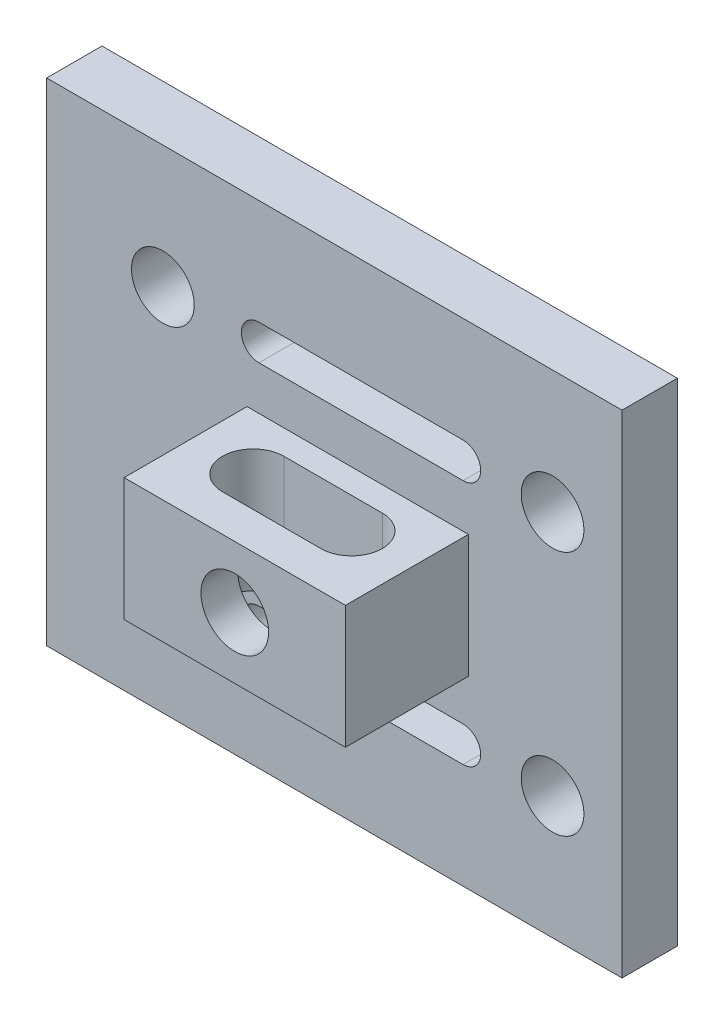
from build123d import *

# Parameters (mm, degrees)
SKETCH_1_W          = 46.8
SKETCH_1_H          = 20
SKETCH_1_R          = 2.55
EXTRUDE_1_DEPTH     = 4.5
CUT_EXTRUDE_1_DEPTH = 8
SKETCH_9_W          = 18
SKETCH_9_H          = 10
EXTRUDE_2_DEPTH     = 10
CUT_EXTRUDE_3_DEPTH = 10
SKETCH_12_R         = 2.75
CUT_EXTRUDE_4_DEPTH = 3


with BuildPart() as part:
    # 草图1 → 凸台-拉伸1 (new body)
    with BuildSketch(Plane.XY):
        with Locations((-1.9, 0)):
            Rectangle(SKETCH_1_W, SKETCH_1_H)
        with Locations((-15.85, 0)):
            Circle(SKETCH_1_R, mode=Mode.SUBTRACT)
        with Locations((15.85, 0)):
            Circle(SKETCH_1_R, mode=Mode.SUBTRACT)
    extrude_1 = extrude(amount=EXTRUDE_1_DEPTH)

    # 草图8 → 切除-拉伸1 (cut)
    with BuildSketch(Plane(origin=(0, 0, 0), x_dir=(-1, 0, 0), z_dir=(0, 0, -1))):
        with BuildLine():
            Line((-8.572541507, 1.430395913), (8.030268199, 1.430395913))
            ThreePointArc((8.030268199, 1.430395913), (9.460664112, 0), (8.030268199, -1.430395913))
            Line((8.030268199, -1.430395913), (-8.572541507, -1.430395913))
            ThreePointArc((-8.572541507, -1.430395913), (-10.00293742, 0), (-8.572541507, 1.430395913))
        make_face()
    cut_extrude_1 = extrude(amount=-CUT_EXTRUDE_1_DEPTH, mode=Mode.SUBTRACT)

    # 镜向1: 凸台-拉伸1 across plane
    add(extrude_1.mirror(Plane.ZX.offset(10)))

    # 镜向3: 切除-拉伸1 across plane
    add(cut_extrude_1.mirror(Plane.ZX.offset(10)), mode=Mode.SUBTRACT)

    # 草图9 → 凸台-拉伸2 (add)
    with BuildSketch(Plane.XY.offset(4.5)):
        with Locations((0, 10)):
            Rectangle(SKETCH_9_W, SKETCH_9_H)
    extrude(amount=EXTRUDE_2_DEPTH)

    # 草图11 → 切除-拉伸3 (cut)
    with BuildSketch(Plane.XZ.offset(-5)):
        with BuildLine():
            Line((-4, 11.5), (4, 11.5))
            ThreePointArc((4, 11.5), (6.5, 9), (4, 6.5))
            Line((4, 6.5), (-4, 6.5))
            ThreePointArc((-4, 6.5), (-6.5, 9), (-4, 11.5))
        make_face()
    extrude(amount=-CUT_EXTRUDE_3_DEPTH, mode=Mode.SUBTRACT)

    # 草图12 → 切除-拉伸4 (cut)
    with BuildSketch(Plane.XY.offset(14.5)):
        with Locations((0, 10)):
            Circle(SKETCH_12_R)
    extrude(amount=-CUT_EXTRUDE_4_DEPTH, mode=Mode.SUBTRACT)


solid = part.part
